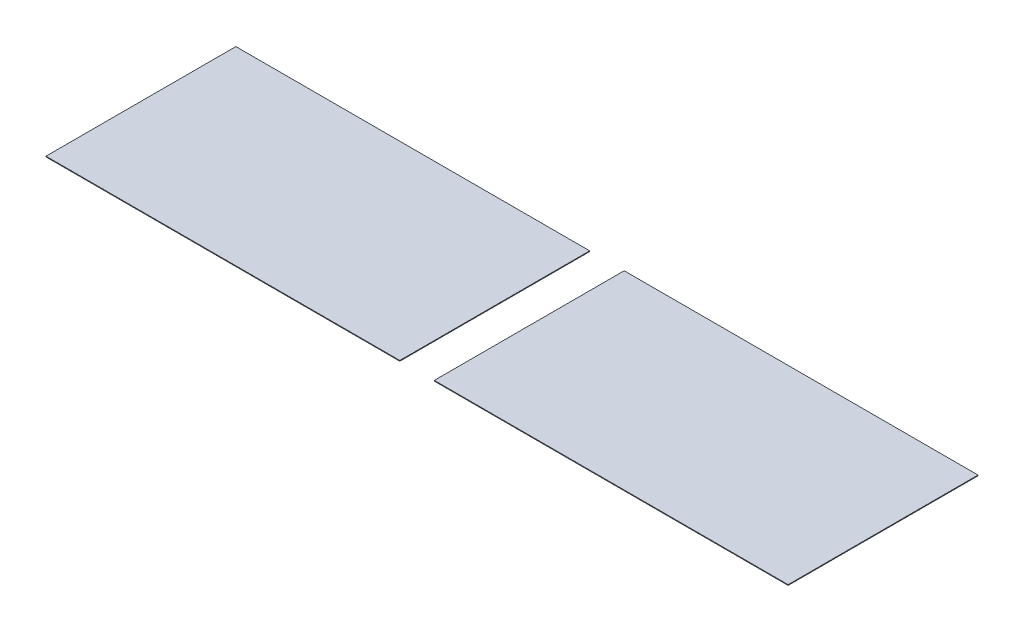
from build123d import *

# Parameters (mm, degrees)
SKETCH_1_W        = 20.5
SKETCH_1_H        = 11
EXTRUDE_1_DEPTH   = 0.04
EXTRUDE_1_2_DEPTH = 0.04


with BuildPart() as part:
    # Эскиз1 → Бобышка-Вытянуть1 (new body)
    with BuildSketch(Plane(origin=(0, 0, 0), x_dir=(1, 0, 0), z_dir=(0, 1, 0))):
        with Locations((10.25, 5.5)):
            Rectangle(SKETCH_1_W, SKETCH_1_H)
    extrude(amount=EXTRUDE_1_DEPTH)


with BuildPart() as body_2:
    # Эскиз1 → Extrude 1 2 (new body)
    with BuildSketch(Plane(origin=(0, 0, 0), x_dir=(1, 0, 0), z_dir=(0, 1, 0))):
        with Locations((32.75, 5.5)):
            Rectangle(SKETCH_1_W, SKETCH_1_H)
    extrude(amount=EXTRUDE_1_2_DEPTH)


solid = Compound([part.part, body_2.part])
